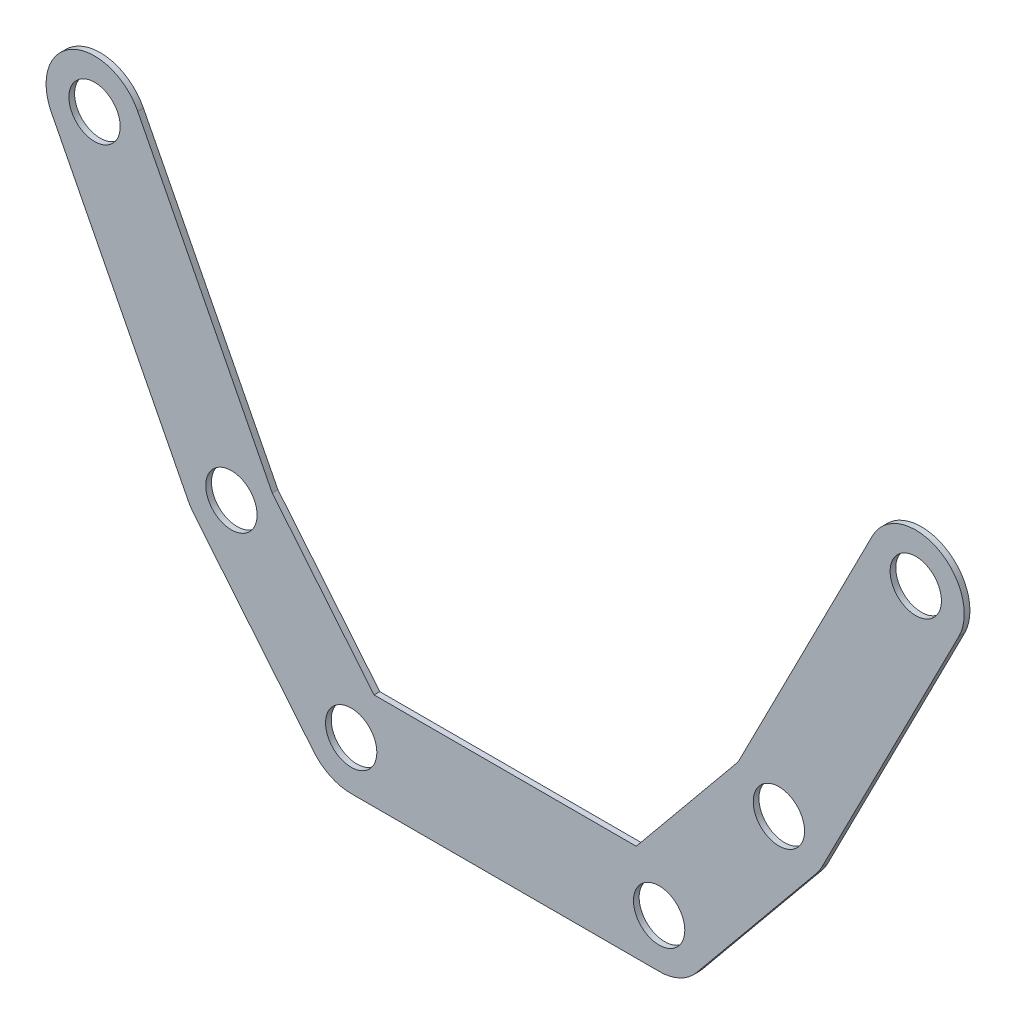
from build123d import *

# Parameters (mm, degrees)
SKETCH2_R           = 14.2875
BOSS_EXTRUDE1_DEPTH = 3.175


with BuildPart() as part:
    # Sketch2 → Boss-Extrude1 (new body)
    with BuildSketch(Plane.XY):
        with BuildLine():
            Line((-252.633177849, 218.001908783), (-176.433177849, 68.837869886))
            ThreePointArc((-176.433177849, 68.837869886), (-174.97190788, 66.322103076), (-173.24831347, 63.978256905))
            Line((-173.24831347, 63.978256905), (-106.57331347, -17.136889499))
            ThreePointArc((-106.57331347, -17.136889499), (-97.254166295, -24.400890984), (-85.725, -26.9875))
            Line((-85.725, -26.9875), (85.725, -26.9875))
            ThreePointArc((85.725, -26.9875), (97.254166295, -24.400890984), (106.57331347, -17.136889499))
            Line((106.57331347, -17.136889499), (173.24831347, 63.978256905))
            ThreePointArc((173.24831347, 63.978256905), (174.97190788, 66.322103076), (176.433177849, 68.837869886))
            Line((176.433177849, 68.837869886), (252.633177849, 218.001908783))
            ThreePointArc((252.633177849, 218.001908783), (240.877276518, 254.31236315), (204.566822151, 242.556461819))
            Line((204.566822151, 242.556461819), (129.696163279, 95.994652474))
            Line((129.696163279, 95.994652474), (72.973687944, 26.9875))
            Line((72.973687944, 26.9875), (-72.973687944, 26.9875))
            Line((-72.973687944, 26.9875), (-129.696163279, 95.994652474))
            Line((-129.696163279, 95.994652474), (-204.566822151, 242.556461819))
            ThreePointArc((-204.566822151, 242.556461819), (-240.877276518, 254.31236315), (-252.633177849, 218.001908783))
        make_face()
        with Locations((-228.6, 230.279185301)):
            Circle(SKETCH2_R, mode=Mode.SUBTRACT)
        with Locations((-152.4, 81.115146404)):
            Circle(SKETCH2_R, mode=Mode.SUBTRACT)
        with Locations((-85.725, 0)):
            Circle(SKETCH2_R, mode=Mode.SUBTRACT)
        with Locations((85.725, 0)):
            Circle(SKETCH2_R, mode=Mode.SUBTRACT)
        with Locations((152.4, 81.115146404)):
            Circle(SKETCH2_R, mode=Mode.SUBTRACT)
        with Locations((228.6, 230.279185301)):
            Circle(SKETCH2_R, mode=Mode.SUBTRACT)
    extrude(amount=BOSS_EXTRUDE1_DEPTH)


solid = part.part
